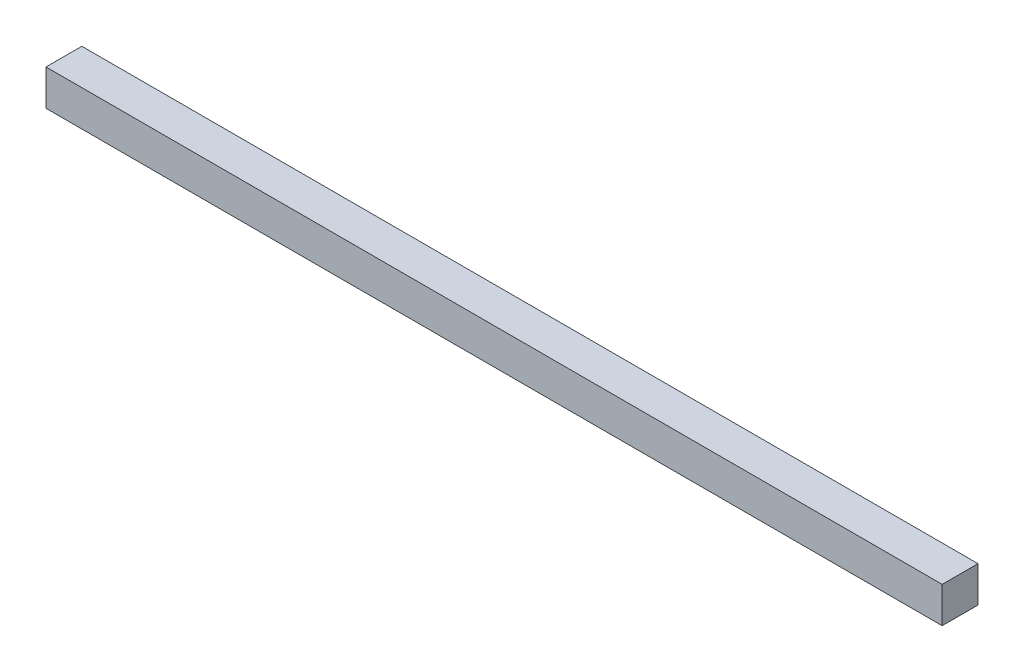
from build123d import *

# Parameters (mm, degrees)
SKETCH2_W           = 100
SKETCH2_H           = 4
BOSS_EXTRUDE1_DEPTH = 4


with BuildPart() as part:
    # Sketch2 → Boss-Extrude1 (new body)
    with BuildSketch(Plane.XY):
        with Locations((50, 2)):
            Rectangle(SKETCH2_W, SKETCH2_H)
    extrude(amount=BOSS_EXTRUDE1_DEPTH)


solid = part.part
